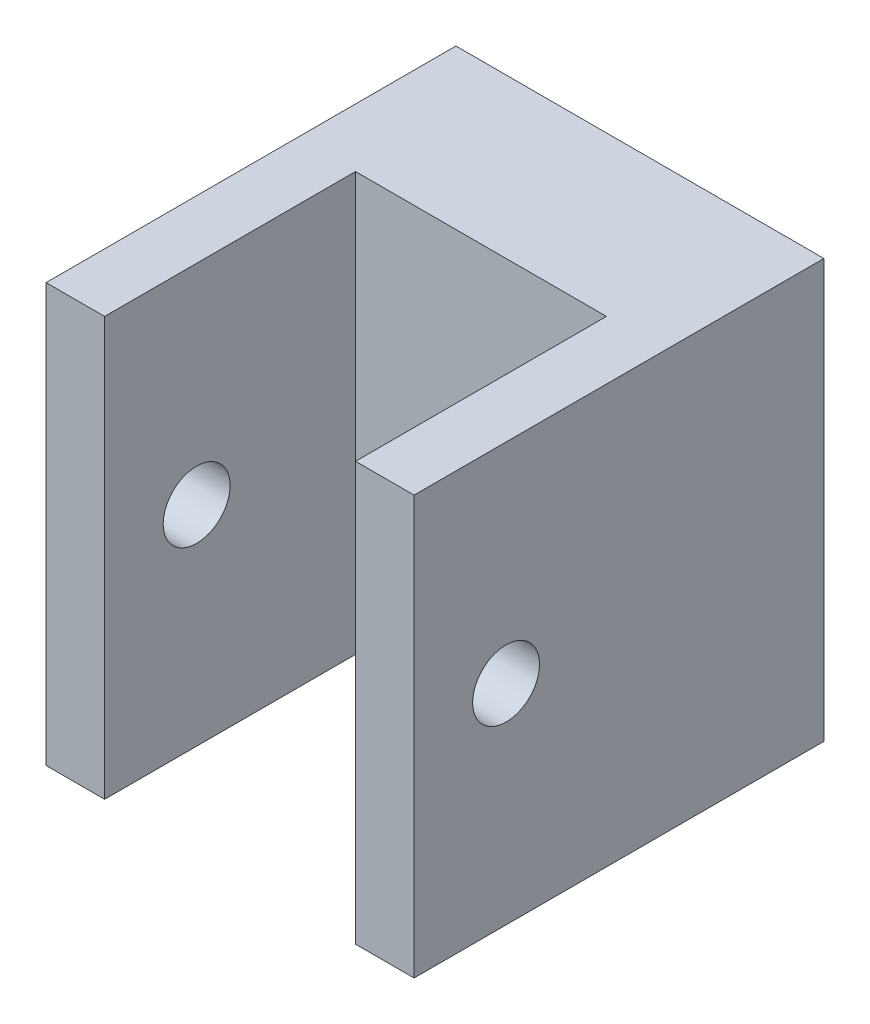
from build123d import *

# Parameters (mm, degrees)
SKETCH1_W           = 7
SKETCH1_H           = 30
BOSS_EXTRUDE1_DEPTH = 50
BOSS_EXTRUDE2_DEPTH = 6
BOSS_EXTRUDE3_DEPTH = 6
CUT_EXTRUDE1_DEPTH  = 75.779676383


with BuildPart() as part:
    # Sketch1 → Boss-Extrude1 (new body)
    with BuildSketch(Plane(origin=(0, 0, 0), x_dir=(1, 0, 0), z_dir=(0, 1, 0))):
        Polygon((-15, -15), (-15, 15), (-15, 22), (-22, 22), (-22, -15), align=None)
        Polygon((-15, 22), (-15, 15), (15, 15), (22, 15), (22, 22), align=None)
        with Locations((18.5, 0)):
            Rectangle(SKETCH1_W, SKETCH1_H)
    extrude(amount=BOSS_EXTRUDE1_DEPTH)

    # Sketch2 → Boss-Extrude2 (add)
    with BuildSketch(Plane(origin=(0, 0, -22), x_dir=(-1, 0, 0), z_dir=(0, 0, -1))):
        with BuildLine():
            Line((12.221813484, 35.179), (12.221813484, 0))
            Line((12.221813484, 0), (22, 0))
            Line((22, 0), (22, 50))
            Line((22, 50), (-22, 50))
            Line((-22, 50), (-22, 0))
            Line((-22, 0), (-15.078186516, 0))
            Line((-15.078186516, 0), (-15.078186516, 10.795))
            ThreePointArc((-15.078186516, 10.795), (-10.078186516, 15.795), (-5.078186516, 10.795))
            Line((-5.078186516, 10.795), (-5.078186516, 0))
            Line((-5.078186516, 0), (2.221813484, 0))
            Line((2.221813484, 0), (2.221813484, 35.179))
            ThreePointArc((2.221813484, 35.179), (7.221813484, 40.179), (12.221813484, 35.179))
        make_face()
    extrude(amount=BOSS_EXTRUDE2_DEPTH)

    # Sketch3 → Boss-Extrude3 (add)
    with BuildSketch(Plane(origin=(0, 0, -28), x_dir=(-1, 0, 0), z_dir=(0, 0, -1))):
        with BuildLine():
            Line((-7.078186516, 10.795), (-7.078186516, 0))
            Line((-7.078186516, 0), (4.221813484, 0))
            Line((4.221813484, 0), (4.221813484, 35.179))
            ThreePointArc((4.221813484, 35.179), (7.221813484, 38.179), (10.221813484, 35.179))
            Line((10.221813484, 35.179), (10.221813484, 0))
            Line((10.221813484, 0), (22, 0))
            Line((22, 0), (22, 50))
            Line((22, 50), (-22, 50))
            Line((-22, 50), (-22, 0))
            Line((-22, 0), (-13.078186516, 0))
            Line((-13.078186516, 0), (-13.078186516, 10.795))
            ThreePointArc((-13.078186516, 10.795), (-10.078186516, 13.795), (-7.078186516, 10.795))
        make_face()
    extrude(amount=BOSS_EXTRUDE3_DEPTH)

    # Sketch5 → Cut-Extrude1 (cut, through all)
    with BuildSketch(Plane.ZY.offset(22)):
        with BuildLine():
            ThreePointArc((0, 25), (1.171572875, 22.171572875), (4, 21))
            Line((4, 21), (4, 29))
            ThreePointArc((4, 29), (1.171572875, 27.828427125), (0, 25))
        make_face()
        with BuildLine():
            Line((4, 29), (4, 21))
            ThreePointArc((4, 21), (6.828427125, 22.171572875), (8, 25))
            ThreePointArc((8, 25), (6.828427125, 27.828427125), (4, 29))
        make_face()
    extrude(amount=-CUT_EXTRUDE1_DEPTH, mode=Mode.SUBTRACT)


solid = part.part
